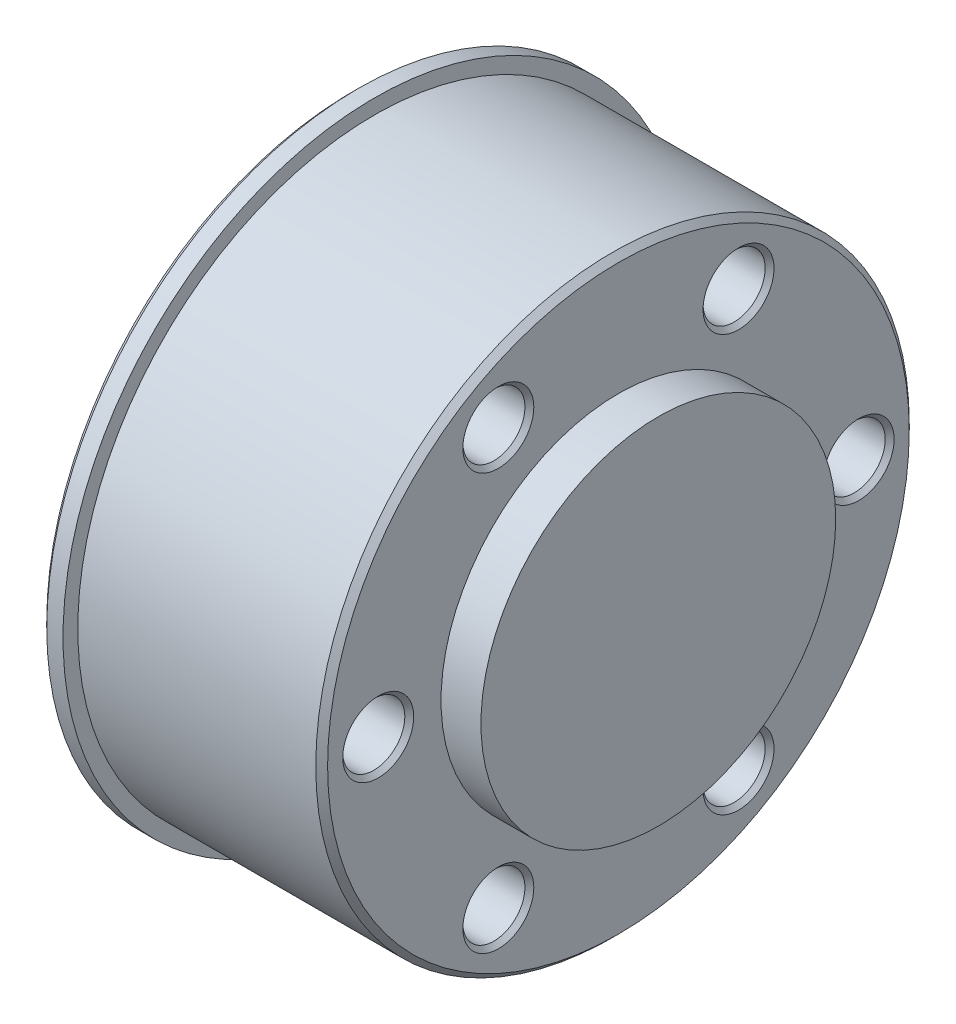
from build123d import *

# Parameters (mm, degrees)
SKETCH3_R          = 1.625
CUT_EXTRUDE1_DEPTH = 12
SKETCH4_R          = 2.1
CUT_EXTRUDE2_DEPTH = 10
CHAMFER1_SIZE      = 0.4
CHAMFER2_SIZE      = 0.4
CHAMFER3_SIZE      = 0.4
CHAMFER4_SIZE      = 0.3
CHAMFER5_SIZE      = 0.4


with BuildPart() as part:
    # Sketch2 → Revolve1 (revolve)
    with BuildSketch(Plane(origin=(0, 0, 0), x_dir=(1, 0, 0), z_dir=(0, 1, 0))):
        Polygon((0, 0), (0, 12), (-2.7, 12), (-2.7, 20.075), (-19.2, 20.075), (-19.2, 21.075), (-20.7, 21.075), (-20.7, 17.727837292), (-20.7, 14.575), (-20.7, 8.1), (-15.7, 8.1), (-15.7, 6), (-13.7, 6), (-13.7, 0), align=None)
    revolve(axis=Axis((0, 0, 0), (-1, 0, 0)))

    # Sketch3 → Cut-Extrude1 (cut)
    with BuildSketch(Plane.ZY.offset(20.7)):
        with Locations((0, 16)):
            Circle(SKETCH3_R)
        with Locations((13.856406461, 7.904729806)):
            Circle(SKETCH3_R)
        with Locations((13.773900052, -8.142905292)):
            Circle(SKETCH3_R)
        with Locations((-0.165012817, -16.095270194)):
            Circle(SKETCH3_R)
        with Locations((-14.021419278, -8)):
            Circle(SKETCH3_R)
        with Locations((-13.938912869, 8.047635097)):
            Circle(SKETCH3_R)
    extrude(amount=-CUT_EXTRUDE1_DEPTH, mode=Mode.SUBTRACT)

    # Sketch4 → Cut-Extrude2 (cut)
    with BuildSketch(Plane(origin=(-2.7, 0, 0), x_dir=(0, 0, -1), z_dir=(1, 0, 0))):
        with Locations((-8.125, 14.072912811)):
            Circle(SKETCH4_R)
        with Locations((8.125, 14.072912811)):
            Circle(SKETCH4_R)
        with Locations((16.25, 0)):
            Circle(SKETCH4_R)
        with Locations((8.125, -14.072912811)):
            Circle(SKETCH4_R)
        with Locations((-8.125, -14.072912811)):
            Circle(SKETCH4_R)
        with Locations((-16.25, 0)):
            Circle(SKETCH4_R)
    extrude(amount=-CUT_EXTRUDE2_DEPTH, mode=Mode.SUBTRACT)

    # Chamfer1
    chamfer1_edges = [part.edges().sort_by_distance(p)[0] for p in [
        (-2.7, 0, 20.075),
    ]]
    chamfer(chamfer1_edges, length=CHAMFER1_SIZE)

    # Chamfer2
    chamfer2_edges = [part.edges().sort_by_distance(p)[0] for p in [
        (-20.7, 0, 8.1),
    ]]
    chamfer(chamfer2_edges, length=CHAMFER2_SIZE)

    # Chamfer3
    chamfer3_edges = [part.edges().sort_by_distance(p)[0] for p in [
        (-20.7, 16, -1.625),
        (-20.7, 8.047635097, -15.563912869),
        (-20.7, -8, -15.646419278),
        (-20.7, -16.095270194, -1.790012817),
        (-20.7, -8.142905292, 12.148900052),
        (-20.7, 7.904729806, 12.231406461),
    ]]
    chamfer(chamfer3_edges, length=CHAMFER3_SIZE)

    # Chamfer4
    chamfer4_edges = [part.edges().sort_by_distance(p)[0] for p in [
        (-2.7, 0, 18.35),
        (-2.7, -14.072912811, 10.225),
        (-2.7, -14.072912811, -6.025),
        (-2.7, 0, -14.15),
        (-2.7, 14.072912811, -6.025),
        (-2.7, 14.072912811, 10.225),
    ]]
    chamfer(chamfer4_edges, length=CHAMFER4_SIZE)

    # Chamfer5
    chamfer5_edges = [part.edges().sort_by_distance(p)[0] for p in [
        (-20.7, 0, 21.075),
    ]]
    chamfer(chamfer5_edges, length=CHAMFER5_SIZE)


solid = part.part
